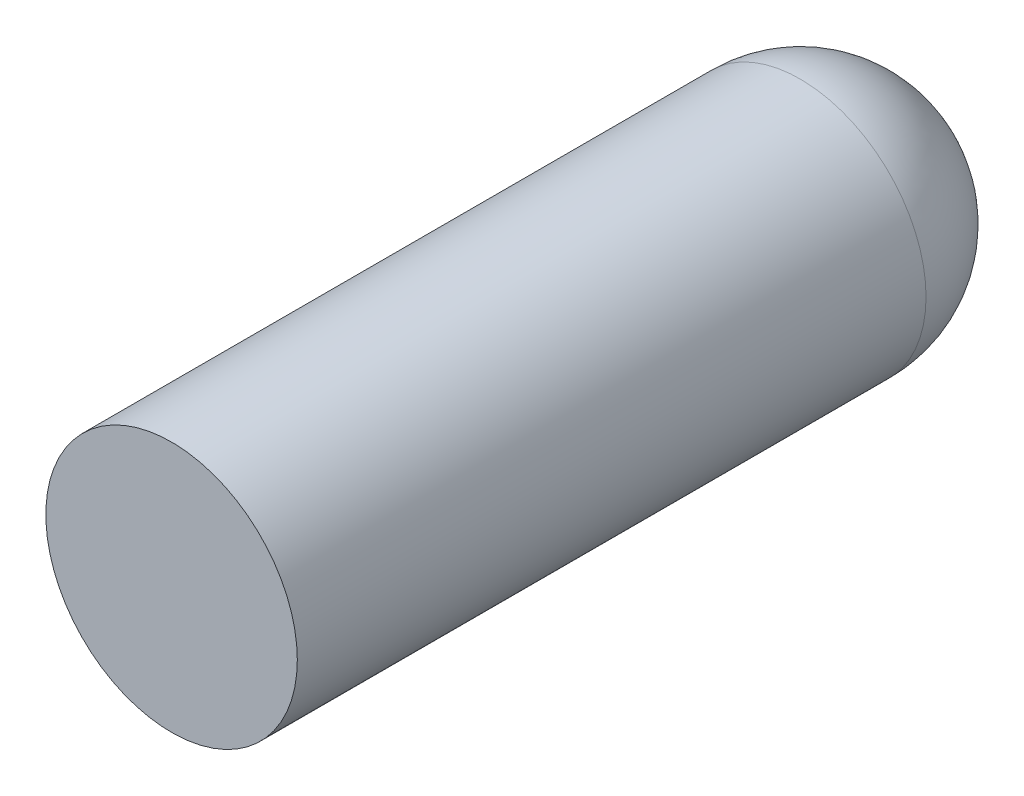
from build123d import *

# Parameters (mm, degrees)
SKETCH_1_R      = 10
EXTRUDE_1_DEPTH = 50


with BuildPart() as part:
    # 草图1 → 凸台-拉伸1 (new body)
    with BuildSketch(Plane.XY):
        Circle(SKETCH_1_R)
    extrude(amount=EXTRUDE_1_DEPTH)

    # 草图2 → 旋转1 (revolve)
    with BuildSketch(Plane(origin=(0, 0, 0), x_dir=(1, 0, 0), z_dir=(0, 1, 0))):
        with BuildLine():
            Line((0, 10), (0, -10))
            ThreePointArc((0, -10), (10, 0), (0, 10))
        make_face()
    revolve(axis=Axis((0, 0, -10), (0, 0, 1)))


solid = part.part
